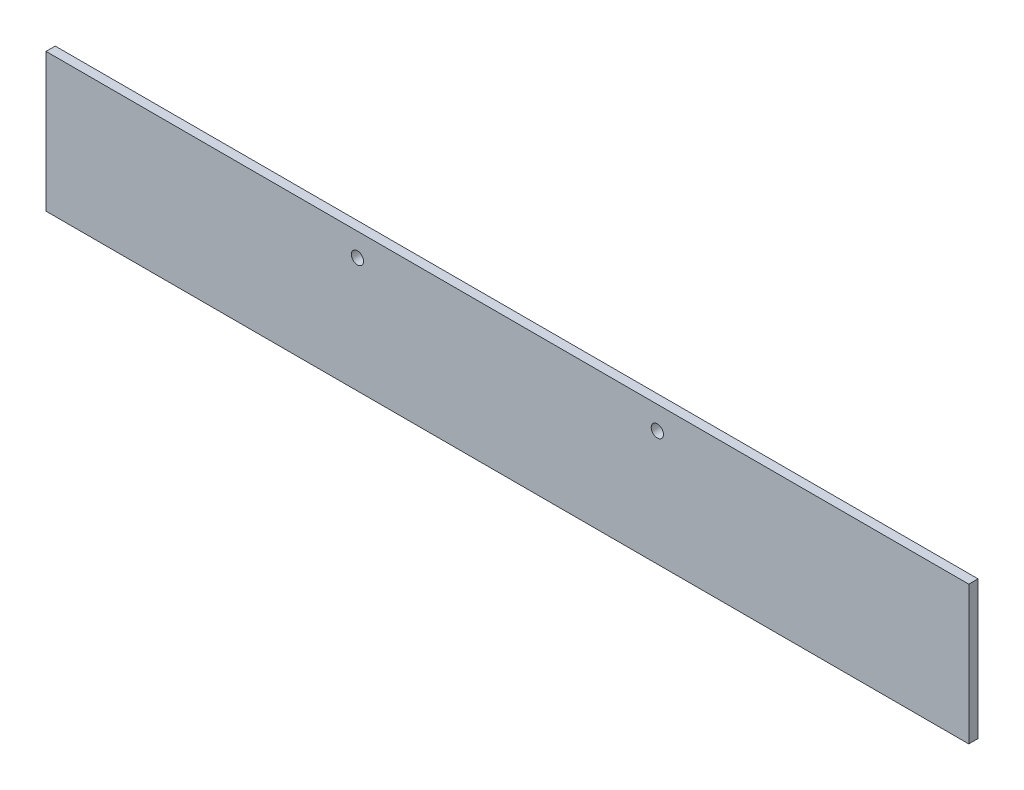
from build123d import *

# Parameters (mm, degrees)
SKETCH_1_W      = 400
SKETCH_1_H      = 60
SKETCH_1_R      = 2.65
EXTRUDE_1_DEPTH = 4


with BuildPart() as part:
    # 草图1 → 凸台-拉伸1 (new body)
    with BuildSketch(Plane.XY):
        Rectangle(SKETCH_1_W, SKETCH_1_H)
        with Locations((-65, 20)):
            Circle(SKETCH_1_R, mode=Mode.SUBTRACT)
        with Locations((65, 20)):
            Circle(SKETCH_1_R, mode=Mode.SUBTRACT)
    extrude(amount=EXTRUDE_1_DEPTH)


solid = part.part
